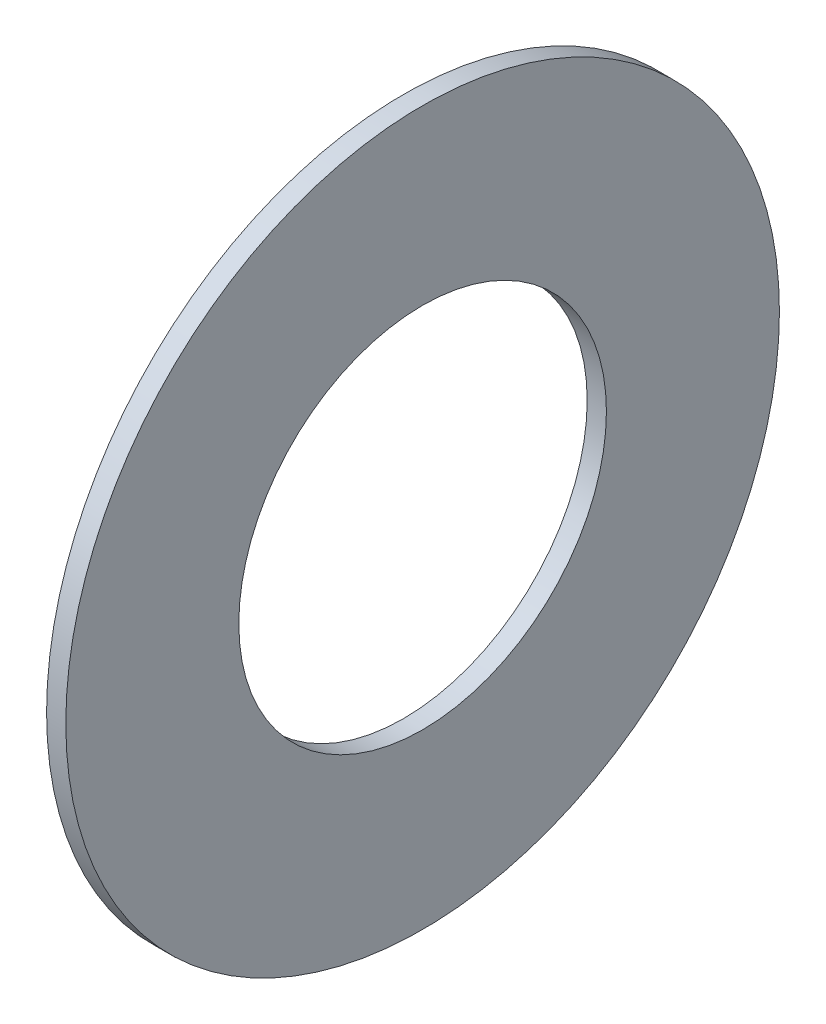
from build123d import *

# Parameters (mm, degrees)
SKETCH_2_W = 0.8
SKETCH_2_H = 7.2


with BuildPart() as part:
    # ｽｹｯﾁ2 → 回転1 (revolve)
    with BuildSketch(Plane.XY, mode=Mode.PRIVATE) as revolve_1_sk:
        with Locations((0, 11.25)):
            Rectangle(SKETCH_2_W, SKETCH_2_H)
    revolve(revolve_1_sk.sketch.rotate(Axis((0, 0, 0), (1, 0, 0)), 90), axis=Axis((0, 0, 0), (1, 0, 0)))


solid = part.part
